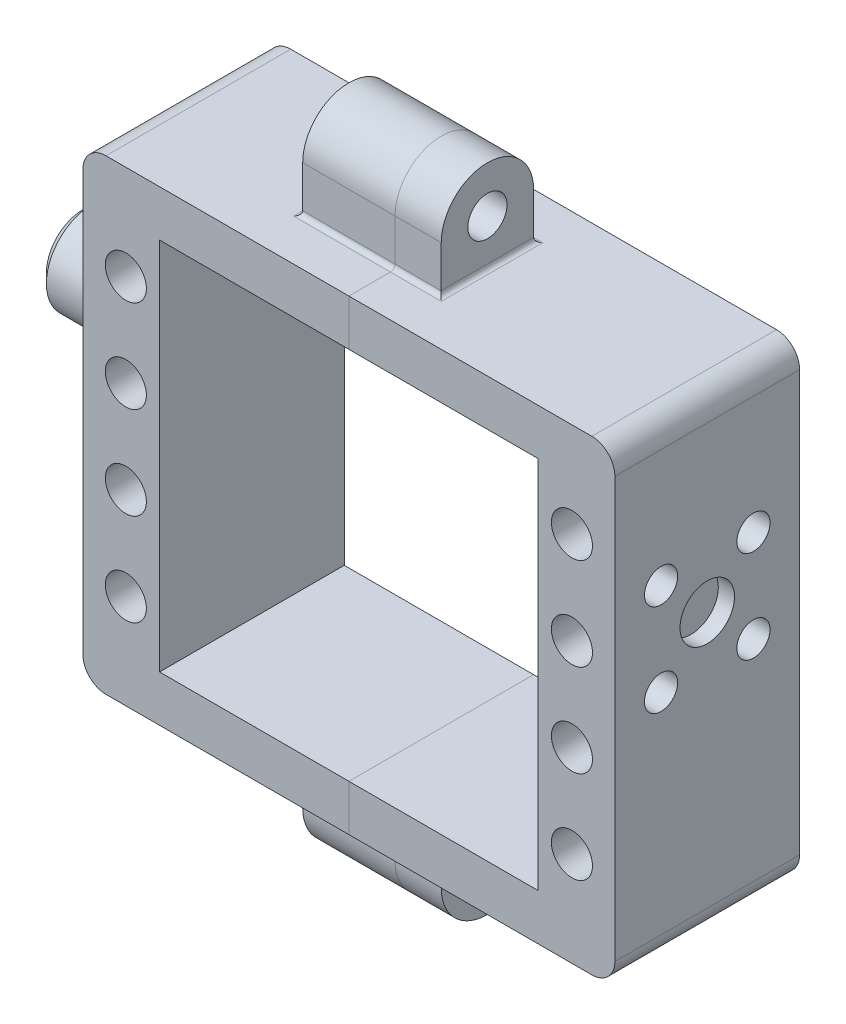
from build123d import *

# Parameters (mm, degrees)
SKETCH1_W                = 57.6
SKETCH1_H                = 50.5
SKETCH1_R                = 2.225
SKETCH1_W_2              = 41
SKETCH1_H_2              = 40.5
BOSS_EXTRUDE1_DEPTH      = 20
FILLET1_R                = 2.5
BOSS_EXTRUDE3_DEPTH      = 10
BOSS_EXTRUDE3_DEPTH_BACK = 5
SKETCH8_R                = 2.125
FILLET5_R                = 0.5
SKETCH9_R                = 2.95
CUT_EXTRUDE3_DEPTH       = 10
SKETCH13_R               = 1.8
CUT_EXTRUDE6_DEPTH       = 8.3
SKETCH14_R               = 2.95
CUT_EXTRUDE7_DEPTH       = 5.5
SKETCH15_R               = 2.95
CUT_EXTRUDE8_DEPTH       = 1.75
SKETCH16_R               = 4.95
SKETCH16_R_2             = 2.95
BOSS_EXTRUDE4_DEPTH      = 10
FILLET6_R                = 1
CHAMFER1_SIZE            = 1


with BuildPart() as part:
    # Sketch1 → Boss-Extrude1 (new body)
    with BuildSketch(Plane.XY):
        with Locations((20.5, 20.25)):
            Rectangle(SKETCH1_W, SKETCH1_H)
        with Locations((-3.65, 25.25)):
            Circle(SKETCH1_R, mode=Mode.SUBTRACT)
        with Locations((-3.65, 35.25)):
            Circle(SKETCH1_R, mode=Mode.SUBTRACT)
        with Locations(Location((-3.65, 5.25, 0), (0, 0, 180))):
            Circle(SKETCH1_R, mode=Mode.SUBTRACT)
        with Locations(Location((-3.65, 15.25, 0), (0, 0, 180))):
            Circle(SKETCH1_R, mode=Mode.SUBTRACT)
        with Locations((44.65, 15.25)):
            Circle(SKETCH1_R, mode=Mode.SUBTRACT)
        with Locations((44.65, 5.25)):
            Circle(SKETCH1_R, mode=Mode.SUBTRACT)
        with Locations(Location((44.65, 35.25, 0), (0, 0, 180))):
            Circle(SKETCH1_R, mode=Mode.SUBTRACT)
        with Locations(Location((44.65, 25.25, 0), (0, 0, 180))):
            Circle(SKETCH1_R, mode=Mode.SUBTRACT)
        with Locations((20.5, 20.25)):
            Rectangle(SKETCH1_W_2, SKETCH1_H_2, mode=Mode.SUBTRACT)
    extrude(amount=BOSS_EXTRUDE1_DEPTH)

    # Fillet1
    fillet1_edges = [part.edges().sort_by_distance(p)[0] for p in [
        (-8.3, 45.5, 10),
        (49.3, 45.5, 10),
        (49.3, -5, 10),
        (-8.3, -5, 10),
    ]]
    fillet(fillet1_edges, radius=FILLET1_R)

    # Sketch8 → Boss-Extrude3 (add, two sides: drawn at the far end of the back side and taken through both)
    # profile 1 of 2: a face of its own
    with BuildSketch(Plane.ZY.offset(-20.5).offset(-BOSS_EXTRUDE3_DEPTH_BACK)):
        with BuildLine():
            Line((5, 45.5), (5, 50.5))
            ThreePointArc((5, 50.5), (10, 55.5), (15, 50.5))
            Line((15, 50.5), (15, 45.5))
            Line((15, 45.5), (5, 45.5))
        make_face()
        with Locations((10, 50.5)):
            Circle(SKETCH8_R, mode=Mode.SUBTRACT)
    # profile 2 of 2: a face of its own
    with BuildSketch(Plane.ZY.offset(-20.5).offset(-BOSS_EXTRUDE3_DEPTH_BACK)):
        with BuildLine():
            Line((15, -5), (15, -10))
            ThreePointArc((15, -10), (10, -15), (5, -10))
            Line((5, -10), (5, -5))
            Line((5, -5), (15, -5))
        make_face()
        with Locations(Location((10, -10, 0), (0, 0, 180))):
            Circle(SKETCH8_R, mode=Mode.SUBTRACT)
    extrude(amount=BOSS_EXTRUDE3_DEPTH + BOSS_EXTRUDE3_DEPTH_BACK)

    # Fillet5
    fillet5_edges = [part.edges().sort_by_distance(p)[0] for p in [
        (10.5, 45.5, 10),
        (18, 45.5, 5),
        (25.5, 45.5, 10),
        (18, 45.5, 15),
    ]]
    fillet(fillet5_edges, radius=FILLET5_R)


with BuildPart() as body_2:
    # Split1: the piece on the far side of the plane
    add(part.part)
    split(bisect_by=Plane(origin=(20.5, 0, 0), x_dir=(0, 0, -1), z_dir=(-1, 0, 0)), keep=Keep.BOTTOM)

    # Sketch13 → Cut-Extrude6 (cut)
    with BuildSketch(Plane(origin=(49.3, 0, 0), x_dir=(0, 0, -1), z_dir=(1, 0, 0))):
        with Locations((-15, 30.25)):
            Circle(SKETCH13_R)
        with Locations((-5, 30.25)):
            Circle(SKETCH13_R)
        with Locations((-15, 20.25)):
            Circle(SKETCH13_R)
        with Locations((-5, 20.25)):
            Circle(SKETCH13_R)
    extrude(amount=-CUT_EXTRUDE6_DEPTH, mode=Mode.SUBTRACT)

    # Sketch14 → Cut-Extrude7 (cut)
    with BuildSketch(Plane.ZY.offset(-41)):
        with Locations((5, 30.25)):
            Circle(SKETCH14_R)
        with Locations((15, 30.25)):
            Circle(SKETCH14_R)
        with Locations((5, 20.25)):
            Circle(SKETCH14_R)
        with Locations((15, 20.25)):
            Circle(SKETCH14_R)
    extrude(amount=-CUT_EXTRUDE7_DEPTH, mode=Mode.SUBTRACT)

    # Sketch15 → Cut-Extrude8 (cut)
    with BuildSketch(Plane(origin=(49.3, 0, 0), x_dir=(0, 0, -1), z_dir=(1, 0, 0))):
        with Locations((-10, 25.25)):
            Circle(SKETCH15_R)
    extrude(amount=-CUT_EXTRUDE8_DEPTH, mode=Mode.SUBTRACT)


with BuildPart() as part_1:
    add(part.part)

    # Split1
    split(bisect_by=Plane(origin=(20.5, 0, 0), x_dir=(0, 0, -1), z_dir=(-1, 0, 0)), keep=Keep.TOP)

    # Sketch9 → Cut-Extrude3 (cut)
    with BuildSketch(Plane.ZY.offset(-10.5)):
        with Locations((10, 50.5)):
            Circle(SKETCH9_R)
        with Locations((10, -10)):
            Circle(SKETCH9_R)
    extrude(amount=-CUT_EXTRUDE3_DEPTH, mode=Mode.SUBTRACT)

    # Sketch16 → Boss-Extrude4 (add)
    # profile 1 of 2: a face of its own
    with BuildSketch(Plane.ZY.offset(8.3)):
        with Locations(Location((10, 25.25, 0), (0, 0, 90))):
            Circle(SKETCH16_R)
        with Locations(Location((10, 25.25, 0), (0, 0, 180))):
            Circle(SKETCH16_R_2, mode=Mode.SUBTRACT)
    # profile 2 of 2: a face of its own
    with BuildSketch(Plane.ZY.offset(8.3)):
        with Locations(Location((10, 25.25, 0), (0, 0, 180))):
            Circle(SKETCH16_R_2)
    extrude(amount=BOSS_EXTRUDE4_DEPTH)

    # Fillet6
    fillet6_edges = [part_1.edges().sort_by_distance(p)[0] for p in [
        (-8.3, 20.3, 10),
    ]]
    fillet(fillet6_edges, radius=FILLET6_R)

    # Chamfer1
    chamfer1_edges = [part_1.edges().sort_by_distance(p)[0] for p in [
        (-18.3, 20.3, 10),
    ]]
    chamfer(chamfer1_edges, length=CHAMFER1_SIZE)


solid = Compound([body_2.part, part_1.part])
